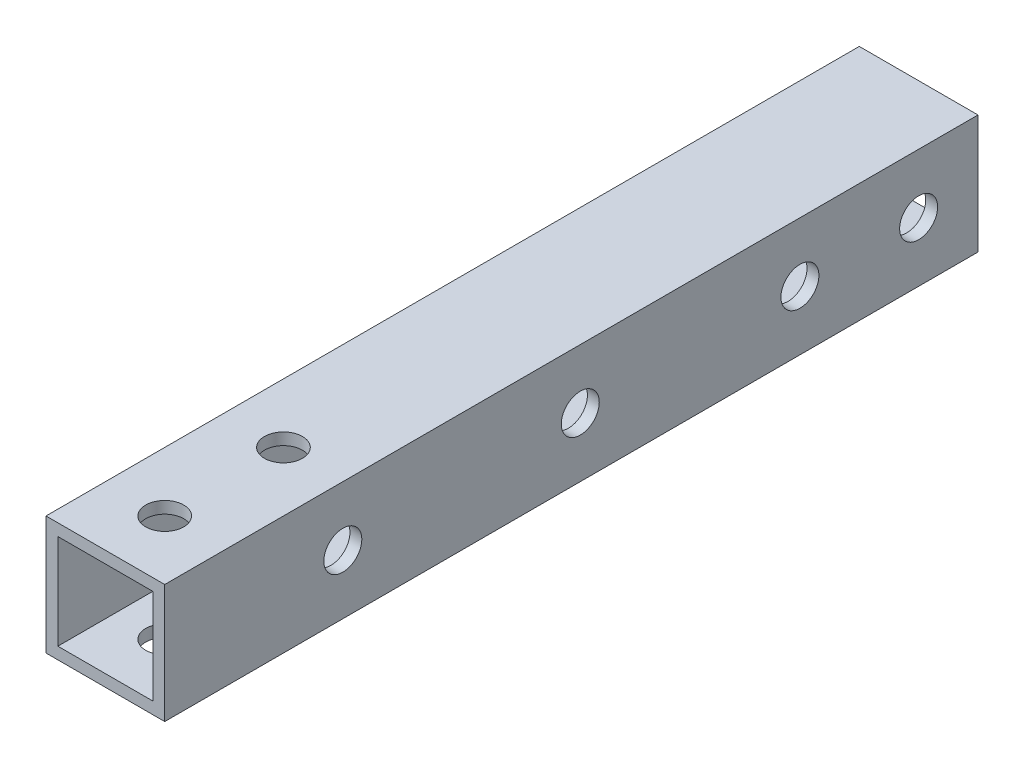
from build123d import *

# Parameters (mm, degrees)
SKETCH_1_W          = 10
SKETCH_1_H          = 10
SKETCH_1_W_2        = 8
SKETCH_1_H_2        = 8
EXTRUDE_1_DEPTH     = 68.5
SKETCH_2_R          = 1.6
CUT_EXTRUDE_1_DEPTH = 70.406411808
SKETCH_3_R          = 1.6
CUT_EXTRUDE_2_DEPTH = 70.406411808
SKETCH_4_R          = 1.6
CUT_EXTRUDE_3_DEPTH = 70.406411808


with BuildPart() as part:
    # ｽｹｯﾁ1 → 押し出し-薄板1 (new body)
    with BuildSketch(Plane.XY):
        Rectangle(SKETCH_1_W, SKETCH_1_H)
        Rectangle(SKETCH_1_W_2, SKETCH_1_H_2, mode=Mode.SUBTRACT)
    extrude(amount=EXTRUDE_1_DEPTH)

    # ｽｹｯﾁ2 → ｶｯﾄ - 押し出し1 (cut, through all)
    with BuildSketch(Plane(origin=(0, 5, 0), x_dir=(1, 0, 0), z_dir=(0, 1, 0))):
        with Locations(Location((0, -63.5, 0), (0, 0, 180))):
            Circle(SKETCH_2_R)
        with Locations(Location((0, -53.5, 0), (0, 0, 180))):
            Circle(SKETCH_2_R)
    extrude(amount=-CUT_EXTRUDE_1_DEPTH, mode=Mode.SUBTRACT)

    # ｽｹｯﾁ3 → ｶｯﾄ - 押し出し2 (cut, through all)
    with BuildSketch(Plane(origin=(5, 0, 0), x_dir=(0, 0, -1), z_dir=(1, 0, 0))):
        with Locations(Location((-5, 0, 0), (0, 0, 90))):
            Circle(SKETCH_3_R)
        with Locations(Location((-15, 0, 0), (0, 0, 90))):
            Circle(SKETCH_3_R)
    extrude(amount=-CUT_EXTRUDE_2_DEPTH, mode=Mode.SUBTRACT)

    # ｽｹｯﾁ4 → ｶｯﾄ - 押し出し3 (cut, through all)
    with BuildSketch(Plane(origin=(5, 0, 0), x_dir=(0, 0, -1), z_dir=(1, 0, 0))):
        with Locations(Location((-53.5, 0, 0), (0, 0, 90))):
            Circle(SKETCH_4_R)
        with Locations(Location((-33.5, 0, 0), (0, 0, 90))):
            Circle(SKETCH_4_R)
    extrude(amount=-CUT_EXTRUDE_3_DEPTH, mode=Mode.SUBTRACT)


solid = part.part
